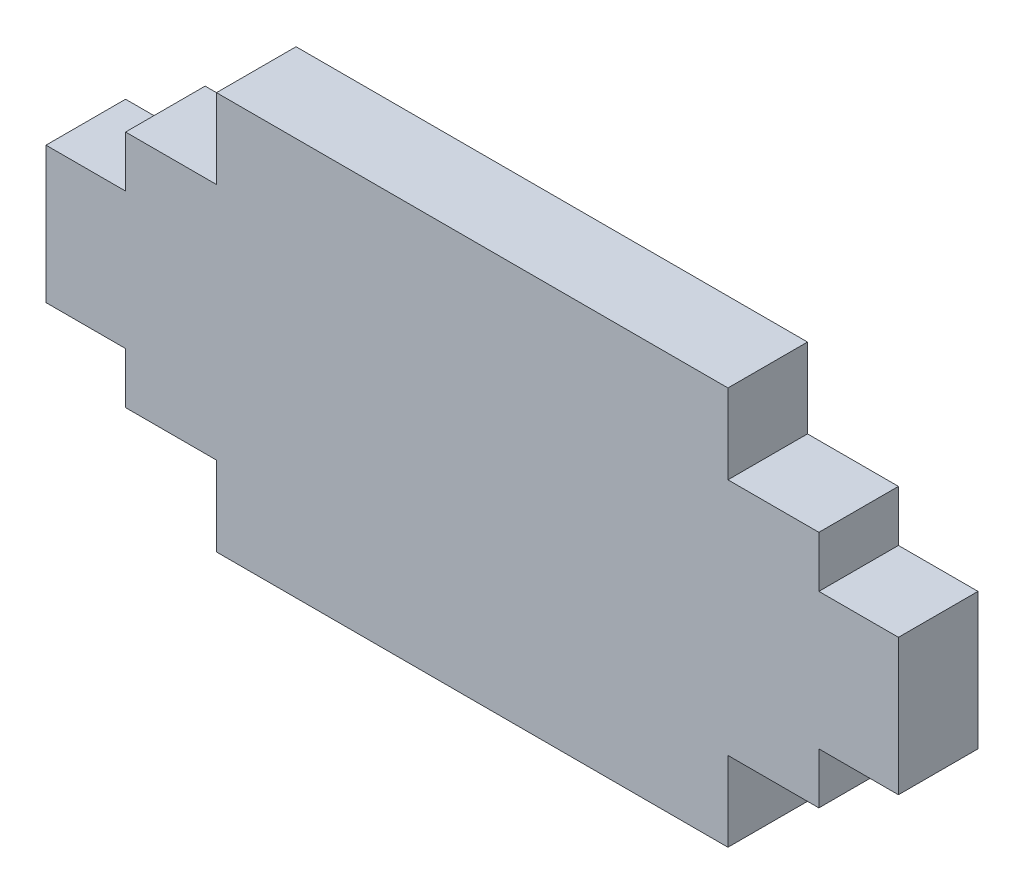
from build123d import *

# Parameters (mm, degrees)
LASER_PROFILE_3P5_DEPTH = 3.5


with BuildPart() as part:
    # Profile_Laser_profile_3p5 → Laser_profile_3p5 (new body)
    with BuildSketch(Plane.XY):
        Polygon((0, -5.25), (4, -5.25), (4, -8.75), (26.5, -8.75), (26.5, -5.25), (30.5, -5.25), (30.5, -3), (34, -3), (34, 3), (30.5, 3), (30.5, 5.25), (26.5, 5.25), (26.5, 8.75), (4, 8.75), (4, 5.25), (0, 5.25), (0, 3), (-3.5, 3), (-3.5, -3), (0, -3), align=None)
    extrude(amount=LASER_PROFILE_3P5_DEPTH)


solid = part.part
